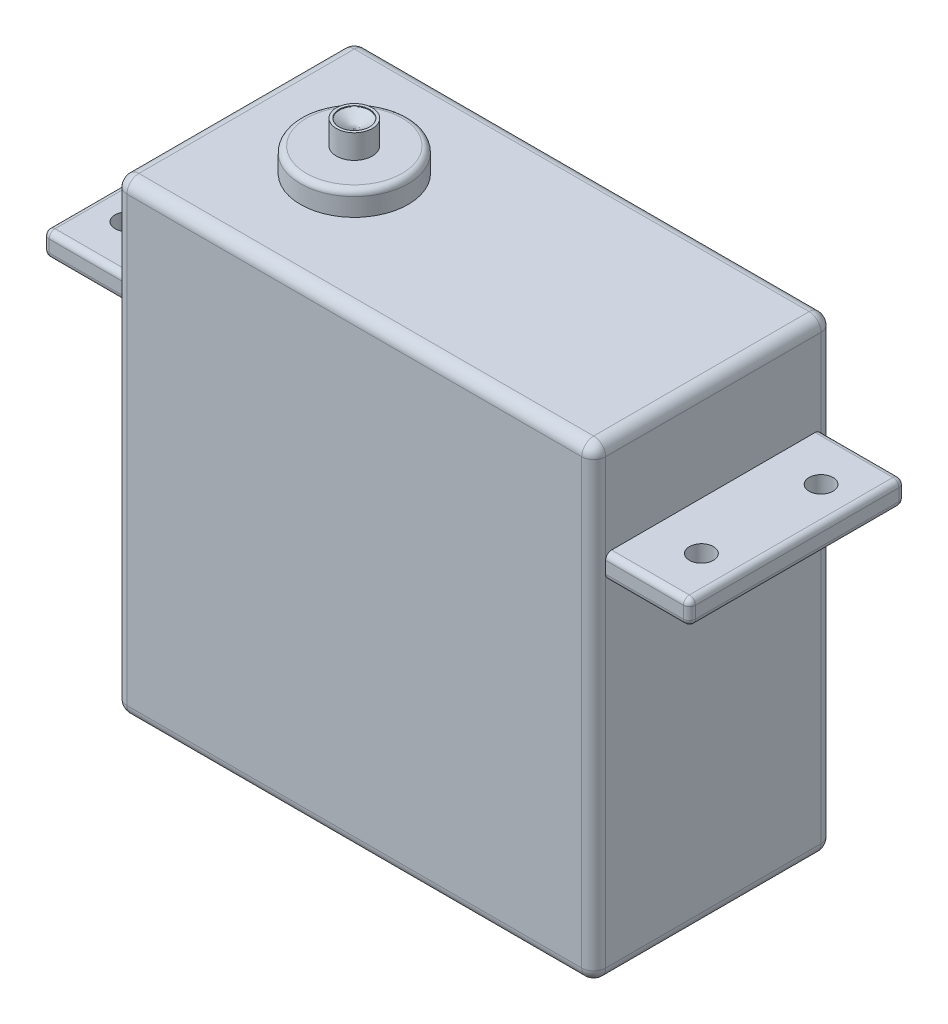
from build123d import *

# Parameters (mm, degrees)
SKETCH_2_W          = 40
SKETCH_2_H          = 39
EXTRUDE_1_DEPTH     = 20
FILLET_1_R          = 1
SKETCH_7_W          = 18
SKETCH_7_H          = 2
EXTRUDE_3_DEPTH     = 7
SKETCH_8_W          = 18
SKETCH_8_H          = 2
EXTRUDE_4_DEPTH     = 7
SKETCH_11_R         = 1
CUT_EXTRUDE_2_DEPTH = 62.079339492
SKETCH_12_R         = 4.5
EXTRUDE_5_DEPTH     = 2
SKETCH_13_R         = 1.5
EXTRUDE_6_DEPTH     = 4
FILLET_2_R          = 0.5
FILLET_3_R          = 0.5
FILLET_4_R          = 0.5
SKETCH_10_R         = 1
CUT_EXTRUDE_3_DEPTH = 62.079339492


with BuildPart() as part:
    # 草图2 → 凸台-拉伸1 (new body)
    with BuildSketch(Plane.XY):
        with Locations((-21.679417753, 9.546852913)):
            Rectangle(SKETCH_2_W, SKETCH_2_H)
    extrude(amount=EXTRUDE_1_DEPTH)

    # 圆角1
    fillet_1_edges = [part.edges().sort_by_distance(p)[0] for p in [
        (-1.679417753, 9.546852913, 20),
        (-21.679417753, 29.046852913, 20),
        (-41.679417753, 9.546852913, 20),
        (-21.679417753, 29.046852913, 0),
        (-1.679417753, 9.546852913, 0),
        (-21.679417753, -9.953147087, 0),
        (-41.679417753, 9.546852913, 0),
        (-41.679417753, 29.046852913, 10),
        (-1.679417753, 29.046852913, 10),
        (-1.679417753, -9.953147087, 10),
        (-41.679417753, -9.953147087, 10),
        (-21.679417753, -9.953147087, 20),
    ]]
    fillet(fillet_1_edges, radius=FILLET_1_R)

    # 草图7 → 凸台-拉伸3 (add)
    with BuildSketch(Plane.ZY.offset(41.679417753)):
        with Locations((10, 20.046852913)):
            Rectangle(SKETCH_7_W, SKETCH_7_H)
    extrude(amount=EXTRUDE_3_DEPTH)

    # 草图8 → 凸台-拉伸4 (add)
    with BuildSketch(Plane(origin=(-1.679417753, 0, 0), x_dir=(0, 0, -1), z_dir=(1, 0, 0))):
        with Locations((-10, 20.046852913)):
            Rectangle(SKETCH_8_W, SKETCH_8_H)
    extrude(amount=EXTRUDE_4_DEPTH)

    # 草图11 → 切除-拉伸2 (cut, through all)
    with BuildSketch(Plane(origin=(0, 21.046852913, 0), x_dir=(1, 0, 0), z_dir=(0, 1, 0))):
        with Locations(Location((2.320582247, -5, 0), (0, 0, 270))):
            Circle(SKETCH_11_R)
        with Locations(Location((2.320582247, -15, 0), (0, 0, 270))):
            Circle(SKETCH_11_R)
    extrude(amount=-CUT_EXTRUDE_2_DEPTH, mode=Mode.SUBTRACT)

    # 草图12 → 凸台-拉伸5 (add)
    with BuildSketch(Plane(origin=(0, 29.046852913, 0), x_dir=(1, 0, 0), z_dir=(0, 1, 0))):
        with Locations(Location((-31.679417753, -10, 0), (0, 0, 270))):
            Circle(SKETCH_12_R)
    extrude(amount=EXTRUDE_5_DEPTH)

    # 草图13 → 凸台-拉伸6 (add)
    with BuildSketch(Plane(origin=(0, 29.046852913, 0), x_dir=(1, 0, 0), z_dir=(0, 1, 0))):
        with Locations(Location((-31.679417753, -10, 0), (0, 0, 270))):
            Circle(SKETCH_13_R)
    extrude(amount=EXTRUDE_6_DEPTH)

    # 圆角2
    fillet_2_edges = [part.edges().sort_by_distance(p)[0] for p in [
        (-31.679417753, 31.046852913, 5.5),
    ]]
    fillet(fillet_2_edges, radius=FILLET_2_R)

    # 草图17 → M3 螺纹孔的螺纹孔钻头1 (revolve, cut)
    with BuildSketch(Plane(origin=(-31.679417753, 33.046852913, 10), x_dir=(0, 0, 1), z_dir=(1, 0, 0))):
        Polygon((0, 0), (0, 0.801075774), (1.25, 0.05), (1.25, 0.025), (1.275, 0), align=None)
    revolve(axis=Axis((-31.679417753, 39.396852913, 10), (0, -1, 0)), mode=Mode.SUBTRACT)

    # 圆角3
    fillet_3_edges = [part.edges().sort_by_distance(p)[0] for p in [
        (-48.679417753, 20.046852913, 1),
        (-45.179417753, 21.046852913, 1),
        (-48.679417753, 19.046852913, 10),
        (-45.179417753, 19.046852913, 1),
        (-48.679417753, 20.046852913, 19),
        (-45.179417753, 19.046852913, 19),
        (-48.679417753, 21.046852913, 10),
        (-45.179417753, 21.046852913, 19),
    ]]
    fillet(fillet_3_edges, radius=FILLET_3_R)

    # 圆角4
    fillet_4_edges = [part.edges().sort_by_distance(p)[0] for p in [
        (1.820582247, 21.046852913, 19),
        (1.820582247, 19.046852913, 19),
        (1.820582247, 19.046852913, 1),
        (1.820582247, 21.046852913, 1),
        (5.320582247, 20.046852913, 19),
        (5.320582247, 19.046852913, 10),
        (5.320582247, 20.046852913, 1),
        (5.320582247, 21.046852913, 10),
    ]]
    fillet(fillet_4_edges, radius=FILLET_4_R)

    # 草图10 → 切除-拉伸3 (cut, through all)
    with BuildSketch(Plane(origin=(0, 21.046852913, 0), x_dir=(1, 0, 0), z_dir=(0, 1, 0))):
        with Locations(Location((-45.679417753, -5, 0), (0, 0, 270))):
            Circle(SKETCH_10_R)
        with Locations(Location((-45.679417753, -15, 0), (0, 0, 270))):
            Circle(SKETCH_10_R)
    extrude(amount=-CUT_EXTRUDE_3_DEPTH, mode=Mode.SUBTRACT)


solid = part.part
